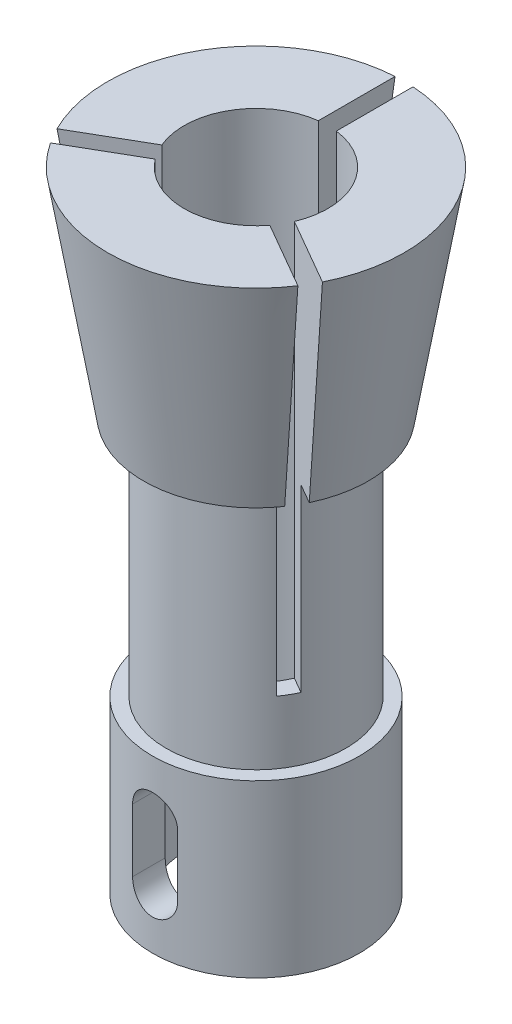
from build123d import *

# Parameters (mm, degrees)
CUT_EXTRUDE1_DEPTH      = 74.786855198
CUT_EXTRUDE1_DEPTH_BACK = 74.786855198
SKETCH3_W               = 2
SKETCH3_H               = 17
CUT_EXTRUDE2_DEPTH      = 44
CIRPATTERN1_COUNT       = 3


with BuildPart() as part:
    # Sketch1 → Revolve1 (revolve)
    with BuildSketch(Plane.XY, mode=Mode.PRIVATE) as revolve1_sk:
        Polygon((8, 0), (11.5, 0), (11.5, 19), (10, 19), (10, 46), (12.5, 46), (16.5, 70), (8, 70), align=None)
    revolve(revolve1_sk.sketch.rotate(Axis((0, 72.635796235, 0), (0, -1, 0)), 90), axis=Axis((0, 72.635796235, 0), (0, -1, 0)))

    # Sketch2 → Cut-Extrude1 (cut, two sides: drawn at the far end of the back side and taken through both)
    with BuildSketch(Plane.XY.offset(-CUT_EXTRUDE1_DEPTH_BACK)):
        with BuildLine():
            Line((2.5, 13), (2.5, 6))
            ThreePointArc((2.5, 6), (0, 3.5), (-2.5, 6))
            Line((-2.5, 6), (-2.5, 13))
            ThreePointArc((-2.5, 13), (0, 15.5), (2.5, 13))
        make_face()
    extrude(amount=CUT_EXTRUDE1_DEPTH + CUT_EXTRUDE1_DEPTH_BACK, mode=Mode.SUBTRACT)

    # Sketch3 → Cut-Extrude2 (cut)
    with BuildSketch(Plane(origin=(0, 70, 0), x_dir=(1, 0, 0), z_dir=(0, 1, 0))):
        with Locations((0, 13.67175851)):
            Rectangle(SKETCH3_W, SKETCH3_H)
    cut_extrude2 = extrude(amount=-CUT_EXTRUDE2_DEPTH, mode=Mode.SUBTRACT)

    # CirPattern1: Cut-Extrude2 ×3 about axis
    cirpattern1_axis = Axis((0, 0, 0), (0, 1, 0))
    for i in range(1, CIRPATTERN1_COUNT):
        add(cut_extrude2.rotate(cirpattern1_axis, i * 360 / CIRPATTERN1_COUNT), mode=Mode.SUBTRACT)


solid = part.part
